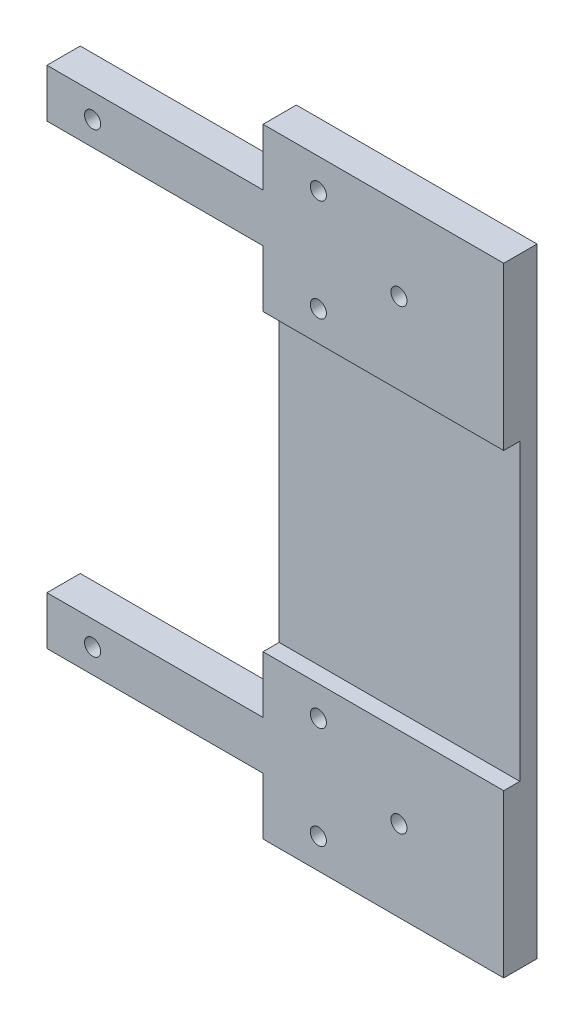
from build123d import *

# Parameters (mm, degrees)
ESBO_O1_R                  = 1.5
RESSALTO_EXTRUS_O3_DEPTH   = 6.2
RESSALTO_EXTRUS_O3_2_DEPTH = 6.2
ESBO_O1_7_W                = 44.78884621
ESBO_O1_7_H                = 54.813199192
RESSALTO_EXTRUS_O4_DEPTH   = 3.2


with BuildPart() as part:
    # Esboço1 → Ressalto-extrusão3 (new body)
    with BuildSketch(Plane.XY):
        Polygon((49.553364079, 16.988852919), (4.764517869, 16.988852919), (4.764517869, 6.395452515), (-35.446635921, 6.395452515), (-35.446635921, -2.604547485), (4.764517869, -2.604547485), (4.764517869, -13.197947889), (49.553364079, -13.197947889), align=None)
        with Locations((-26.946635921, 1.895452515)):
            Circle(ESBO_O1_R, mode=Mode.SUBTRACT)
        with Locations((15.053364079, -7.604547485)):
            Circle(ESBO_O1_R, mode=Mode.SUBTRACT)
        with Locations((15.053364079, 11.395452515)):
            Circle(ESBO_O1_R, mode=Mode.SUBTRACT)
        with Locations((30.053364079, 1.895452515)):
            Circle(ESBO_O1_R, mode=Mode.SUBTRACT)
    extrude(amount=RESSALTO_EXTRUS_O3_DEPTH)



with BuildPart() as body_2:
    # Esboço1 → Ressalto-extrus_o3 2 (new body)
    with BuildSketch(Plane.XY):
        Polygon((4.764517869, 82.395452515), (4.764517869, 71.802052111), (49.553364079, 71.802052111), (49.553364079, 101.988852919), (4.764517869, 101.988852919), (4.764517869, 91.395452515), (-35.446635921, 91.395452515), (-35.446635921, 82.395452515), align=None)
        with Locations((-26.946635921, 86.895452515)):
            Circle(ESBO_O1_R, mode=Mode.SUBTRACT)
        with Locations((15.053364079, 77.395452515)):
            Circle(ESBO_O1_R, mode=Mode.SUBTRACT)
        with Locations((15.053364079, 96.395452515)):
            Circle(ESBO_O1_R, mode=Mode.SUBTRACT)
        with Locations((30.053364079, 86.895452515)):
            Circle(ESBO_O1_R, mode=Mode.SUBTRACT)
    extrude(amount=RESSALTO_EXTRUS_O3_2_DEPTH)


with BuildPart() as part_1:
    add(part.part)

    add(body_2.part)  # Ressalto-extrusão4 merges body 2
    # Esboço1<7> → Ressalto-extrusão4 (add)
    with BuildSketch(Plane.XY):
        with Locations((27.158940974, 44.395452515)):
            Rectangle(ESBO_O1_7_W, ESBO_O1_7_H)
    extrude(amount=RESSALTO_EXTRUS_O4_DEPTH)


solid = part_1.part
